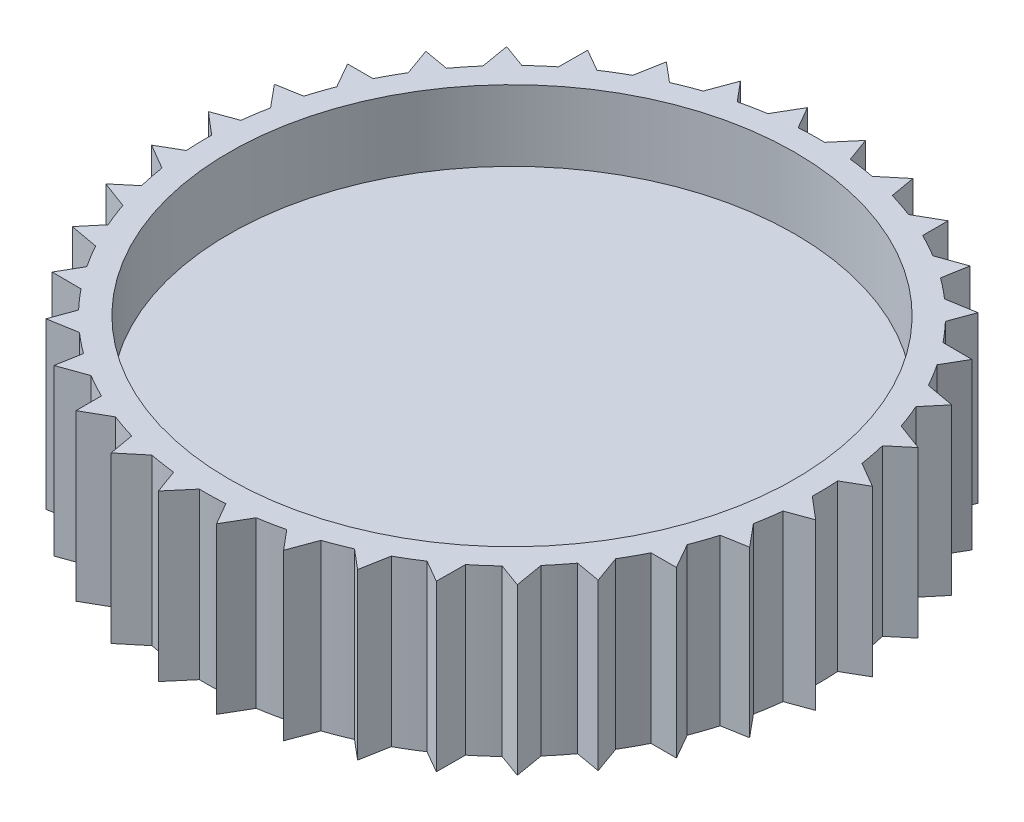
from build123d import *

# Parameters (mm, degrees)
SKETCH_1_R          = 13
EXTRUDE_1_DEPTH     = 7
SKETCH_2_R          = 12
CUT_EXTRUDE_1_DEPTH = 3
EXTRUDE_2_DEPTH     = 7


with BuildPart() as part:
    # 草图1 → 凸台-拉伸1 (new body)
    with BuildSketch(Plane(origin=(0, 0, 0), x_dir=(1, 0, 0), z_dir=(0, 1, 0))):
        with Locations(Location((0, 0, 0), (0, 0, 270))):
            Circle(SKETCH_1_R)
    extrude(amount=EXTRUDE_1_DEPTH)

    # 草图2 → 切除-拉伸1 (cut)
    with BuildSketch(Plane(origin=(0, 7, 0), x_dir=(1, 0, 0), z_dir=(0, 1, 0))):
        with Locations(Location((0, 0, 0), (0, 0, 270))):
            Circle(SKETCH_2_R)
    extrude(amount=-CUT_EXTRUDE_1_DEPTH, mode=Mode.SUBTRACT)

    # 草图3 → 凸台-拉伸2 (add, through all)
    with BuildSketch(Plane(origin=(0, 7, 0), x_dir=(1, 0, 0), z_dir=(0, 1, 0))):
        Polygon((-12.123665589, 4.692199131), (-11.044603538, 4.692199131), (-11.653830585, 5.760922904), (-12.732892635, 5.760922904), align=None)
        Polygon((-11.124688039, 6.726166519), (-10.062019365, 6.53878936), (-10.476408948, 7.697067984), (-11.539077622, 7.884445143), align=None)
        Polygon((-9.787692472, 8.555762741), (-8.773705825, 8.186701784), (-8.980666927, 9.399341549), (-9.994653573, 9.768402506), align=None)
        Polygon((-8.153302822, 10.125396442), (-7.218807673, 9.585865416), (-7.212051886, 10.816020876), (-8.146547034, 11.355551902), align=None)
        Polygon((-6.271179191, 11.387375095), (-5.444569703, 10.693767379), (-5.224302297, 11.904060883), (-6.050911785, 12.597668599), align=None)
        Polygon((-4.198508954, 12.303354118), (-3.504901238, 11.47674463), (-3.077814927, 12.630402023), (-3.771422644, 13.457011511), align=None)
        Polygon((-1.998269147, 12.845501953), (-1.458738122, 11.911006804), (-0.837809708, 12.97297479), (-1.377340734, 13.907469938), align=None)
        Polygon((0.262687056, 12.99734571), (0.631748014, 11.983359064), (1.427651935, 12.921370282), (1.058590978, 13.935356928), align=None)
        Polygon((2.515661647, 12.754271695), (2.703038805, 11.691603022), (3.649735097, 12.477156476), (3.462357938, 13.53982515), align=None)
        Polygon((4.692199131, 12.123665589), (4.692199131, 11.044603538), (5.760922904, 11.653830585), (5.760922904, 12.732892635), align=None)
        Polygon((6.726166519, 11.124688039), (6.53878936, 10.062019365), (7.697067984, 10.476408948), (7.884445143, 11.539077622), align=None)
        Polygon((8.555762741, 9.787692472), (8.186701784, 8.773705825), (9.399341549, 8.980666927), (9.768402506, 9.994653573), align=None)
        Polygon((10.125396442, 8.153302822), (9.585865416, 7.218807673), (10.816020876, 7.212051886), (11.355551902, 8.146547034), align=None)
        Polygon((11.387375095, 6.271179191), (10.693767379, 5.444569703), (11.904060883, 5.224302297), (12.597668599, 6.050911785), align=None)
        Polygon((12.303354118, 4.198508954), (11.47674463, 3.504901238), (12.630402023, 3.077814927), (13.457011511, 3.771422644), align=None)
        Polygon((12.845501953, 1.998269147), (11.911006804, 1.458738122), (12.97297479, 0.837809708), (13.907469938, 1.377340734), align=None)
        Polygon((12.99734571, -0.262687056), (11.983359064, -0.631748014), (12.921370282, -1.427651935), (13.935356928, -1.058590978), align=None)
        Polygon((12.754271695, -2.515661647), (11.691603022, -2.703038805), (12.477156476, -3.649735097), (13.53982515, -3.462357938), align=None)
        Polygon((12.123665589, -4.692199131), (11.044603538, -4.692199131), (11.653830585, -5.760922904), (12.732892635, -5.760922904), align=None)
        Polygon((11.124688039, -6.726166519), (10.062019365, -6.53878936), (10.476408948, -7.697067984), (11.539077622, -7.884445143), align=None)
        Polygon((9.787692472, -8.555762741), (8.773705825, -8.186701784), (8.980666927, -9.399341549), (9.994653573, -9.768402506), align=None)
        Polygon((8.153302822, -10.125396442), (7.218807673, -9.585865416), (7.212051886, -10.816020876), (8.146547034, -11.355551902), align=None)
        Polygon((6.271179191, -11.387375095), (5.444569703, -10.693767379), (5.224302297, -11.904060883), (6.050911785, -12.597668599), align=None)
        Polygon((4.198508954, -12.303354118), (3.504901238, -11.47674463), (3.077814927, -12.630402023), (3.771422644, -13.457011511), align=None)
        Polygon((1.998269147, -12.845501953), (1.458738122, -11.911006804), (0.837809708, -12.97297479), (1.377340734, -13.907469938), align=None)
        Polygon((-0.262687056, -12.99734571), (-0.631748014, -11.983359064), (-1.427651935, -12.921370282), (-1.058590978, -13.935356928), align=None)
        Polygon((-2.515661647, -12.754271695), (-2.703038805, -11.691603022), (-3.649735097, -12.477156476), (-3.462357938, -13.53982515), align=None)
        Polygon((-4.692199131, -12.123665589), (-4.692199131, -11.044603538), (-5.760922904, -11.653830585), (-5.760922904, -12.732892635), align=None)
        Polygon((-6.726166519, -11.124688039), (-6.53878936, -10.062019365), (-7.697067984, -10.476408948), (-7.884445143, -11.539077622), align=None)
        Polygon((-8.555762741, -9.787692472), (-8.186701784, -8.773705825), (-9.399341549, -8.980666927), (-9.768402506, -9.994653573), align=None)
        Polygon((-10.125396442, -8.153302822), (-9.585865416, -7.218807673), (-10.816020876, -7.212051886), (-11.355551902, -8.146547034), align=None)
        Polygon((-11.387375095, -6.271179191), (-10.693767379, -5.444569703), (-11.904060883, -5.224302297), (-12.597668599, -6.050911785), align=None)
        Polygon((-12.303354118, -4.198508954), (-11.47674463, -3.504901238), (-12.630402023, -3.077814927), (-13.457011511, -3.771422644), align=None)
        Polygon((-12.845501953, -1.998269147), (-11.911006804, -1.458738122), (-12.97297479, -0.837809708), (-13.907469938, -1.377340734), align=None)
        Polygon((-12.99734571, 0.262687056), (-11.983359064, 0.631748014), (-12.921370282, 1.427651935), (-13.935356928, 1.058590978), align=None)
        Polygon((-12.754271695, 2.515661647), (-11.691603022, 2.703038805), (-12.477156476, 3.649735097), (-13.53982515, 3.462357938), align=None)
    extrude(amount=-EXTRUDE_2_DEPTH)


solid = part.part
